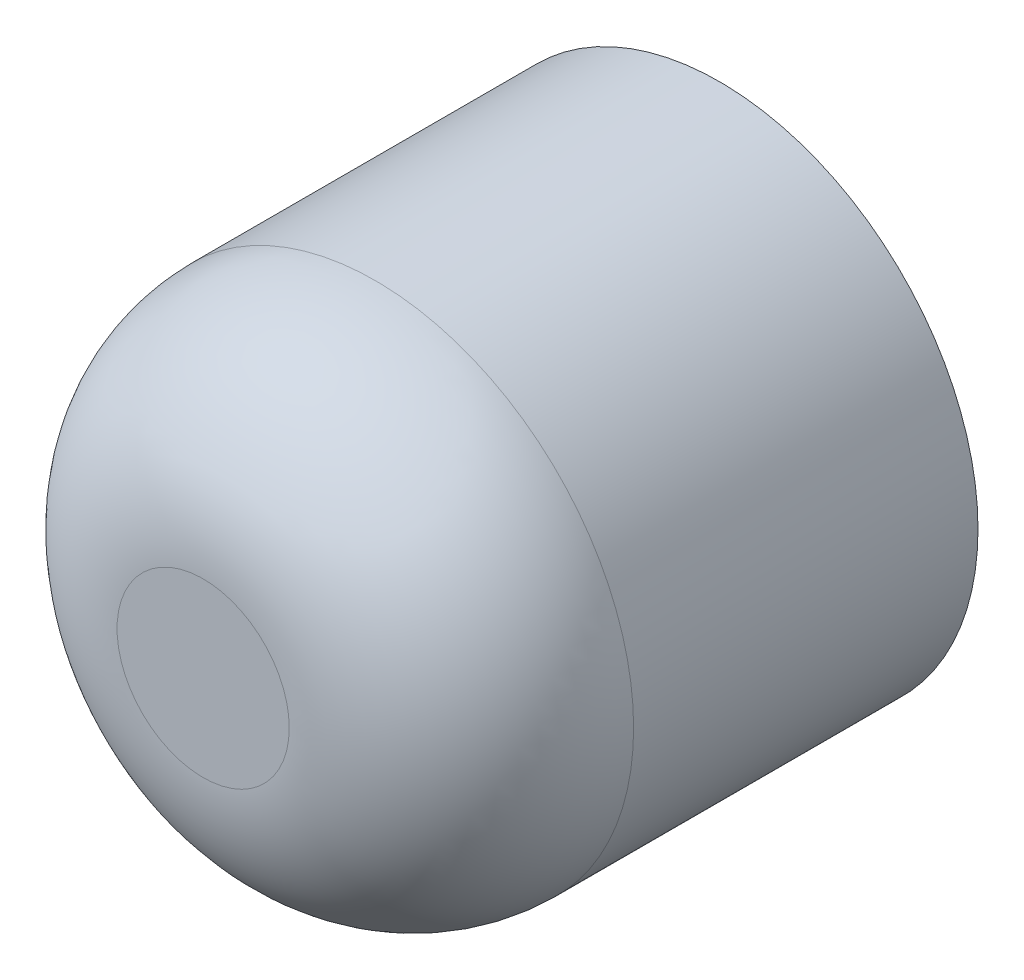
from build123d import *

# Parameters (mm, degrees)
SKETCH_1_R          = 1.5
EXTRUDE_1_DEPTH     = 3
FILLET_1_R          = 1
CUT_EXTRUDE_1_DEPTH = 1.5


with BuildPart() as part:
    # 草图1 → 凸台-拉伸1 (new body)
    with BuildSketch(Plane.XY):
        Circle(SKETCH_1_R)
    extrude(amount=EXTRUDE_1_DEPTH)

    # 圆角1
    fillet_1_edges = [part.edges().sort_by_distance(p)[0] for p in [
        (-1.5, 0, 3),
    ]]
    fillet(fillet_1_edges, radius=FILLET_1_R)

    # 草图2 → 切除-拉伸1 (cut)
    with BuildSketch(Plane(origin=(0, 0, 0), x_dir=(-1, 0, 0), z_dir=(0, 0, -1))):
        Polygon((0.866025404, 0), (0.433012702, 0.75), (-0.433012702, 0.75), (-0.866025404, 0), (-0.433012702, -0.75), (0.433012702, -0.75), align=None)
    extrude(amount=-CUT_EXTRUDE_1_DEPTH, mode=Mode.SUBTRACT)


solid = part.part
